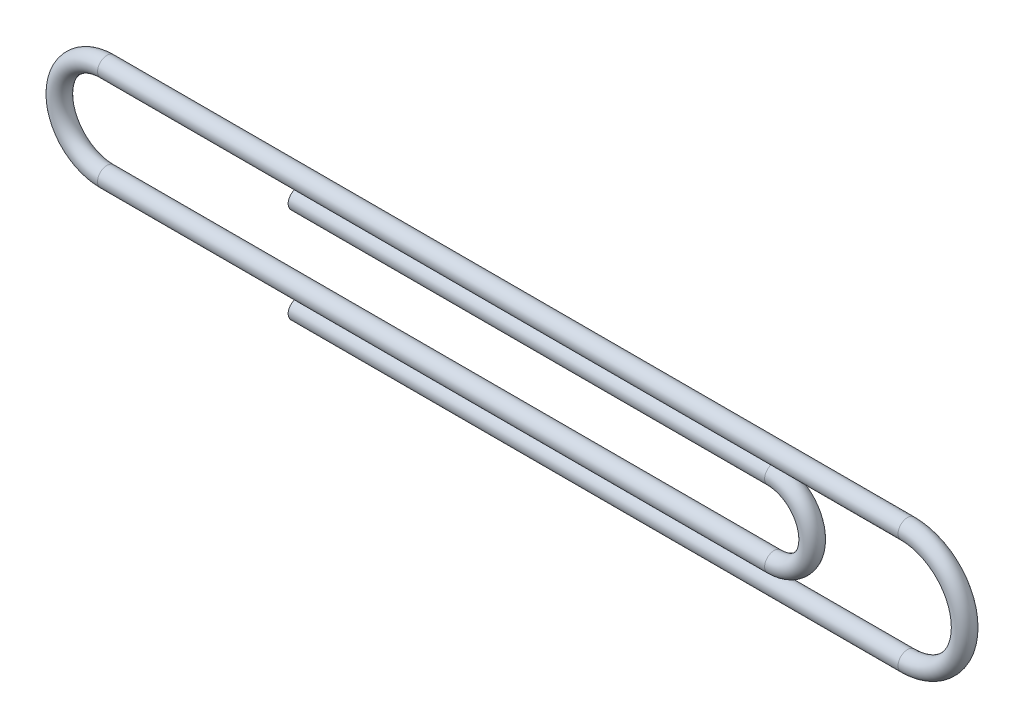
from build123d import *

# Parameters (mm, degrees)
SKETCH3_R = 0.495


with BuildPart() as part:
    # Sweep1: sweep along a path in Sketch1
    with BuildLine(Plane.XY) as sweep1_path:
        Line((0, 0), (25, 0))
        ThreePointArc((25, 0), (27, -2), (25, -4))
        Line((25, -4), (-10, -4))
        ThreePointArc((-10, -4), (-12.5, -1.5), (-10, 1))
        Line((-10, 1), (32, 1))
        ThreePointArc((32, 1), (35, -2), (32, -5))
        Line((32, -5), (0, -5))
    # Sketch3 → Sweep1 (sweep)
    with BuildSketch(Plane(origin=(0, 0, 0), x_dir=(0, 0, -1), z_dir=(1, 0, 0))):
        Circle(SKETCH3_R)
    sweep(path=sweep1_path.line)


solid = part.part
